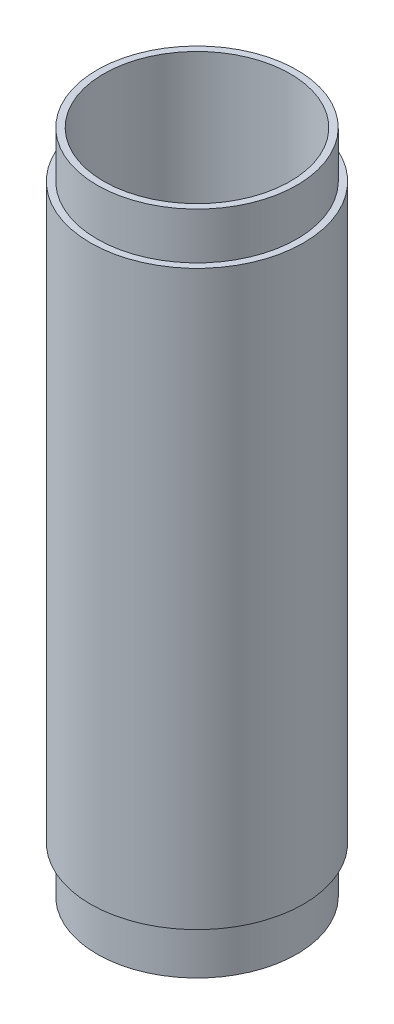
from build123d import *

# Parameters (mm, degrees)
SALIENTE_EXTRUIR1_DEPTH      = 50
SALIENTE_EXTRUIR1_DEPTH_BACK = 50
CROQUIS10_R                  = 15
CROQUIS10_R_2                = 14
SALIENTE_EXTRUIR2_DEPTH      = 43
SALIENTE_EXTRUIR2_DEPTH_BACK = 43
CROQUIS9_R                   = 16
CROQUIS9_R_2                 = 14


with BuildPart() as part:
    # Croquis10 → Saliente-Extruir1 (new, two sides: drawn at the far end of the back side and taken through both)
    with BuildSketch(Plane(origin=(0, 50, 0), x_dir=(1, 0, 0), z_dir=(0, 1, 0)).offset(-SALIENTE_EXTRUIR1_DEPTH_BACK)):
        Circle(CROQUIS10_R)
        Circle(CROQUIS10_R_2, mode=Mode.SUBTRACT)
    extrude(amount=SALIENTE_EXTRUIR1_DEPTH + SALIENTE_EXTRUIR1_DEPTH_BACK)

    # Croquis9 → Saliente-Extruir2 (add, two sides: drawn at the far end of the back side and taken through both)
    with BuildSketch(Plane(origin=(0, 50, 0), x_dir=(1, 0, 0), z_dir=(0, 1, 0)).offset(-SALIENTE_EXTRUIR2_DEPTH_BACK)):
        Circle(CROQUIS9_R)
        Circle(CROQUIS9_R_2, mode=Mode.SUBTRACT)
    extrude(amount=SALIENTE_EXTRUIR2_DEPTH + SALIENTE_EXTRUIR2_DEPTH_BACK)


solid = part.part
